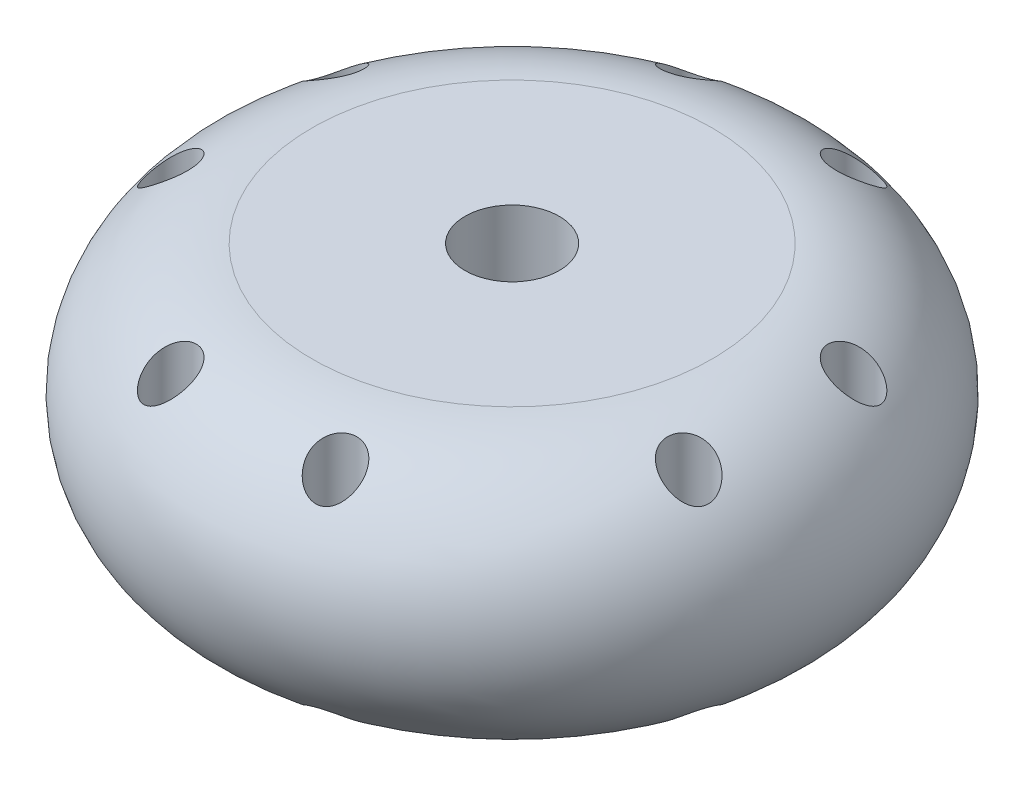
from build123d import *
from build123d.topology import SkipClean

# Parameters (mm, degrees)
SKETCH2_R          = 2
CUT_EXTRUDE1_DEPTH = 46.299006735
CIRPATTERN1_COUNT  = 4
SKETCH4_R          = 4
CUT_EXTRUDE3_DEPTH = 46.299006784


with BuildPart() as part:
    # Sketch1 → Revolve2 (revolve)
    with BuildSketch(Plane.XY, mode=Mode.PRIVATE) as revolve2_sk:
        with BuildLine():
            Line((0, 0), (-17, 0))
            ThreePointArc((-17, 0), (-28, -11), (-17, -22))
            Line((-17, -22), (0, -22))
            Line((0, -22), (0, 0))
        make_face()
    revolve(revolve2_sk.sketch.rotate(Axis((0, -22, 0), (0, 1, 0)), 270), axis=Axis((0, -22, 0), (0, 1, 0)))

    # Sketch2 → Cut-Extrude1 (cut, through all)
    with SkipClean():  # the faces are left unmerged after this step: merging them gives an invalid solid
        with BuildSketch(Plane(origin=(0, 0, 0), x_dir=(1, 0, 0), z_dir=(0, 1, 0))):
            with Locations(Location((7, 22, 0), (0, 0, 171.31326608))):
                Circle(SKETCH2_R)
            with Locations(Location((-7, 22, 0), (0, 0, 132.600597515))):
                Circle(SKETCH2_R)
        cut_extrude1 = extrude(amount=-CUT_EXTRUDE1_DEPTH, mode=Mode.SUBTRACT)

    # CirPattern1: Cut-Extrude1 ×4 about axis
    with SkipClean():  # the faces are left unmerged after this step: merging them gives an invalid solid
        cirpattern1_axis = Axis((0, 0, 0), (0, 1, 0))
        for i in range(1, CIRPATTERN1_COUNT):
            add(cut_extrude1.rotate(cirpattern1_axis, i * 360 / CIRPATTERN1_COUNT), mode=Mode.SUBTRACT)

    # Sketch4 → Cut-Extrude3 (cut, through all)
    with SkipClean():  # the faces are left unmerged after this step: merging them gives an invalid solid
        with BuildSketch(Plane(origin=(0, 0, 0), x_dir=(1, 0, 0), z_dir=(0, 1, 0))):
            with Locations(Location((0, 0, 0), (0, 0, 270))):
                Circle(SKETCH4_R)
        extrude(amount=-CUT_EXTRUDE3_DEPTH, mode=Mode.SUBTRACT)


solid = part.part
